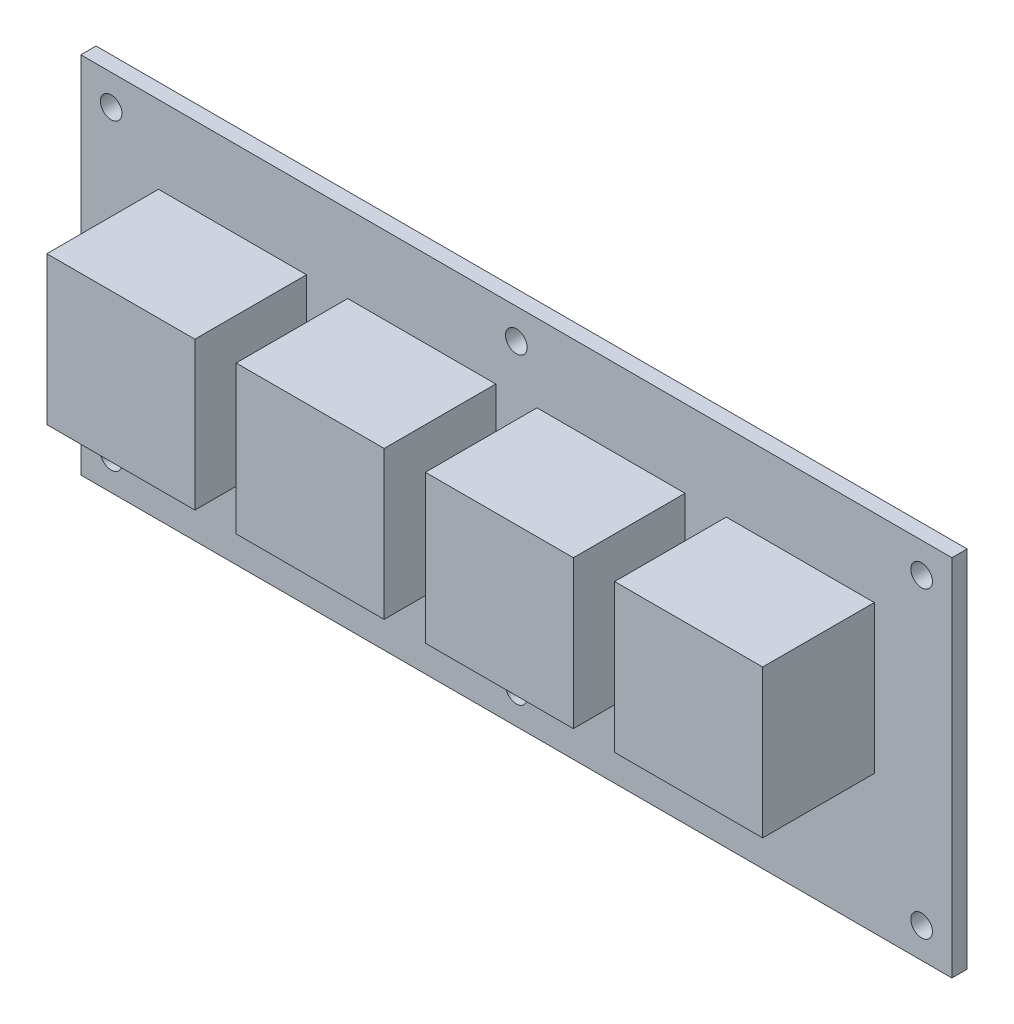
from build123d import *

# Parameters (mm, degrees)
SKETCH1_W          = 91.186
SKETCH1_H          = 38.1
BOARD_DEPTH        = 1.592072
SKETCH3_W          = 15.494
SKETCH3_H          = 15.494
MX1A_1_DEPTH       = 11.684
SKETCH4_W          = 15.494
SKETCH4_H          = 15.494
MX1A_2_DEPTH       = 11.684
SKETCH5_W          = 15.494
SKETCH5_H          = 15.494
MX1A_3_DEPTH       = 11.684
SKETCH6_W          = 15.494
SKETCH6_H          = 15.494
MX1A_4_DEPTH       = 11.684
SKETCH7_R          = 1.1303
CUT_EXTRUDE1_DEPTH = 10


with BuildPart() as part:
    # Sketch1 → BOARD (new body)
    with BuildSketch(Plane.XY):
        with Locations((45.593, 19.05)):
            Rectangle(SKETCH1_W, SKETCH1_H)
    extrude(amount=BOARD_DEPTH)

    # Sketch7 → Cut-Extrude1 (cut)
    with BuildSketch(Plane.XY.offset(1.592072)):
        with Locations((88.011, 34.925)):
            Circle(SKETCH7_R)
        with Locations((88.011, 3.175)):
            Circle(SKETCH7_R)
        with Locations((45.593, 34.925)):
            Circle(SKETCH7_R)
        with Locations((45.593, 3.175)):
            Circle(SKETCH7_R)
        with Locations((3.175, 34.925)):
            Circle(SKETCH7_R)
        with Locations((3.175, 3.175)):
            Circle(SKETCH7_R)
    extrude(amount=-CUT_EXTRUDE1_DEPTH, mode=Mode.SUBTRACT)


with BuildPart() as body_2:
    # Sketch3 → MX1A-1 (new body)
    with BuildSketch(Plane.XY.offset(1.592072)):
        with Locations((75.311, 22.225)):
            Rectangle(SKETCH3_W, SKETCH3_H)
    extrude(amount=MX1A_1_DEPTH)


with BuildPart() as body_3:
    # Sketch4 → MX1A-2 (new body)
    with BuildSketch(Plane.XY.offset(1.592072)):
        with Locations((55.499, 22.225)):
            Rectangle(SKETCH4_W, SKETCH4_H)
    extrude(amount=MX1A_2_DEPTH)


with BuildPart() as body_4:
    # Sketch5 → MX1A-3 (new body)
    with BuildSketch(Plane.XY.offset(1.592072)):
        with Locations((35.687, 22.225)):
            Rectangle(SKETCH5_W, SKETCH5_H)
    extrude(amount=MX1A_3_DEPTH)


with BuildPart() as body_5:
    # Sketch6 → MX1A-4 (new body)
    with BuildSketch(Plane.XY.offset(1.592072)):
        with Locations((15.875, 22.225)):
            Rectangle(SKETCH6_W, SKETCH6_H)
    extrude(amount=MX1A_4_DEPTH)


solid = Compound([part.part, body_2.part, body_3.part, body_4.part, body_5.part])
